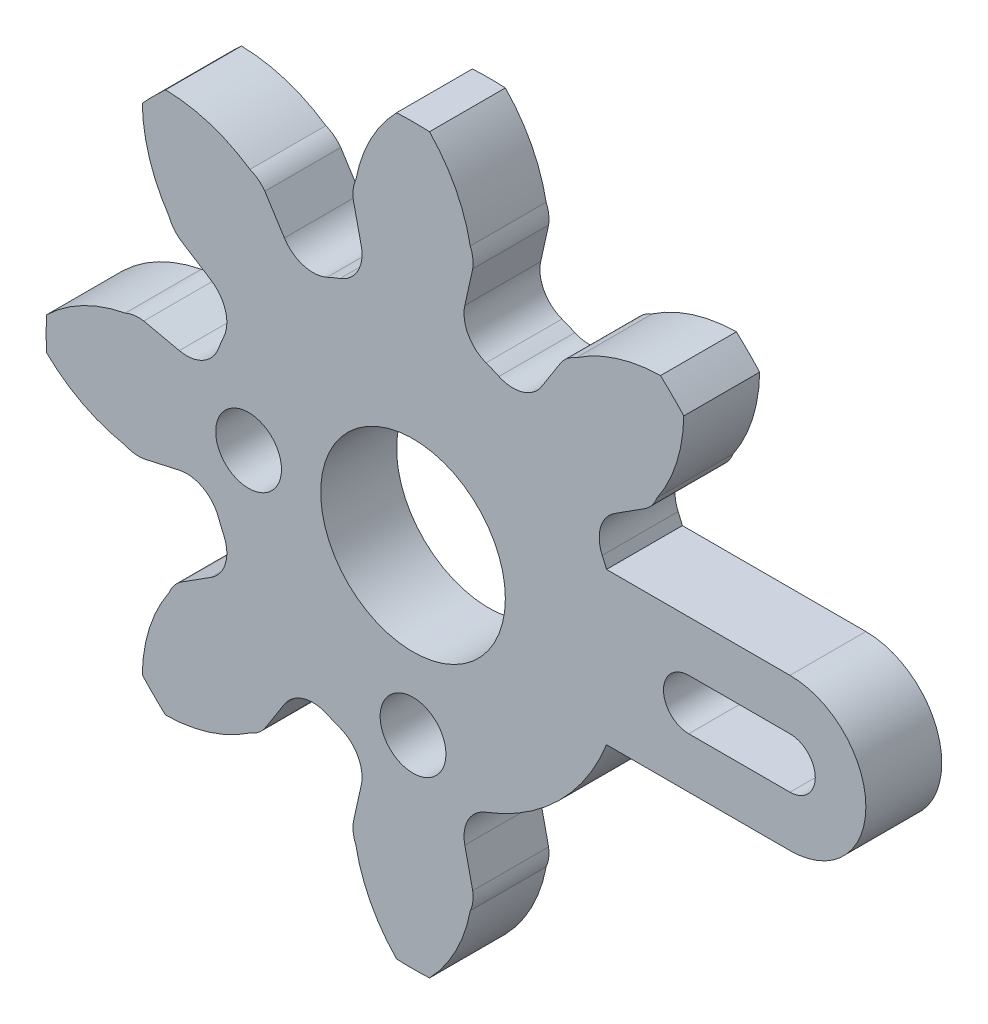
from build123d import *

# Parameters (mm, degrees)
POSICIONAMENTOS_R               = 8.2157
BASE_DEPTH                      = 3
FURO_DE_DI_METRO_2_6_2_6_1_D    = 2.6
BASE_DENTE_DEPTH                = 3
RAIO_DENTE_R                    = 1.342367201
PADR_OCIRCULAR1_COUNT           = 8
RAIO_DENTE_OF_PADR_OCIRCULAR1_R = 1.342367201
RESSALTO_EXTRUS_O1_DEPTH        = 3
FURO_DE_DI_METRO_7_3_7_3_1_D    = 7.3


with BuildPart() as part:
    # Posicionamentos → Base (new body)
    with BuildSketch(Plane.XY):
        Circle(POSICIONAMENTOS_R)
    extrude(amount=BASE_DEPTH)

    # Furo de diâmetro Ø2.6 (2.6)1 (through all)
    with Locations(Plane.XY.offset(3)):
        with Locations((0, -6.5), (-6.5, 0)):
            Hole(FURO_DE_DI_METRO_2_6_2_6_1_D / 2)

    # Dente → Base Dente (add, through all)
    with BuildSketch(Plane.XY):
        with BuildLine():
            Line((2.358922349, 10.642131153), (1.777928991, 8.021015833))
            ThreePointArc((1.777928991, 8.021015833), (0, 8.2157), (-1.777928991, 8.021015833))
            Line((-1.777928991, 8.021015833), (-2.358922349, 10.642131153))
            ThreePointArc((-2.358922349, 10.642131153), (-2.364262787, 11.016570047), (-2.263047735, 11.377109253))
            ThreePointArc((-2.263047735, 11.377109253), (-1.685191659, 13.049606095), (-0.650923694, 14.48538223))
            ThreePointArc((-0.650923694, 14.48538223), (0, 14.5), (0.650923694, 14.48538223))
            ThreePointArc((0.650923694, 14.48538223), (1.685191659, 13.049606095), (2.263047735, 11.377109253))
            ThreePointArc((2.263047735, 11.377109253), (2.364262787, 11.016570047), (2.358922349, 10.642131153))
        make_face()
    base_dente = extrude(amount=BASE_DENTE_DEPTH)

    # Raio Dente
    raio_dente_edges = [part.edges().sort_by_distance(p)[0] for p in [
        (-1.777928991, 8.021015833, 1.5),
        (1.777928991, 8.021015833, 1.5),
    ]]
    fillet(raio_dente_edges, radius=RAIO_DENTE_R)

    # PadrãoCircular1: Base Dente ×8 about axis, 2 skipped
    padr_ocircular1_axis = Axis((0, 0, 0), (0, 0, -1))
    add([base_dente.rotate(padr_ocircular1_axis, i * 360 / PADR_OCIRCULAR1_COUNT) for i in range(1, PADR_OCIRCULAR1_COUNT) if i not in (2, 3)])

    # Raio Dente of PadrãoCircular1
    raio_dente_of_padr_ocircular1_edges = [part.edges().sort_by_distance(p)[0] for p in [
        (4.414529041, 6.928900334, 1.5),
        (6.928900334, 4.414529041, 1.5),
        (1.777928991, -8.021015833, 1.5),
        (-1.777928991, -8.021015833, 1.5),
        (-4.414529041, -6.928900334, 1.5),
        (-6.928900334, -4.414529041, 1.5),
        (-8.021015833, -1.777928991, 1.5),
        (-8.021015833, 1.777928991, 1.5),
        (-6.928900334, 4.414529041, 1.5),
        (-4.414529041, 6.928900334, 1.5),
    ]]
    fillet(raio_dente_of_padr_ocircular1_edges, radius=RAIO_DENTE_OF_PADR_OCIRCULAR1_R)

    # Encaixe → Ressalto-extrusão1 (add, through all)
    with BuildSketch(Plane.XY):
        with BuildLine():
            Line((0, 3), (14.900434401, 3))
            ThreePointArc((14.900434401, 3), (17.900434401, 0), (14.900434401, -3))
            Line((14.900434401, -3), (0, -3))
            Line((0, -3), (0, 3))
        make_face()
        with BuildLine():
            Line((10.900434401, 1), (14.900434401, 1))
            ThreePointArc((14.900434401, 1), (15.900434401, 0), (14.900434401, -1))
            Line((14.900434401, -1), (10.900434401, -1))
            ThreePointArc((10.900434401, -1), (9.900434401, 0), (10.900434401, 1))
        make_face(mode=Mode.SUBTRACT)
    extrude(amount=RESSALTO_EXTRUS_O1_DEPTH)

    # Furo de diâmetro Ø7.3 (7.3)1 (through all)
    with Locations(Plane.XY.offset(3)):
        with Locations((0, 0)):
            Hole(FURO_DE_DI_METRO_7_3_7_3_1_D / 2)


solid = part.part
